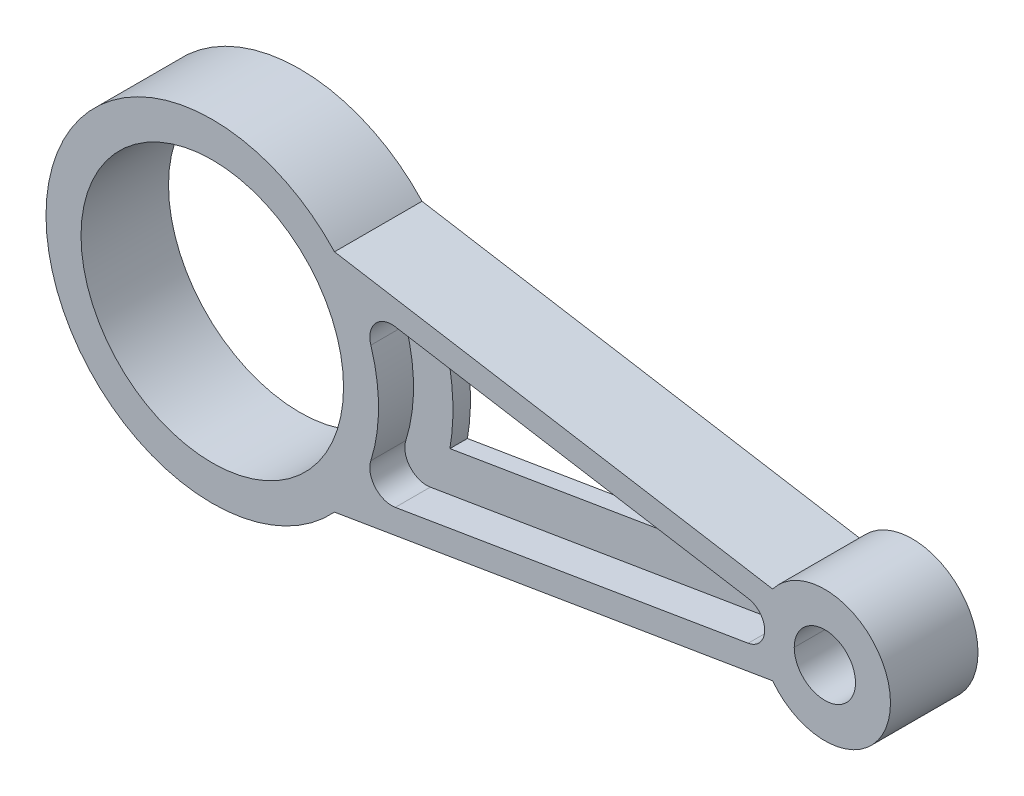
from build123d import *

# Parameters (mm, degrees)
SKETCH1_R           = 30
SKETCH1_R_2         = 7
BOSS_EXTRUDE1_DEPTH = 10
CUT_EXTRUDE1_DEPTH  = 8
CUT_EXTRUDE2_DEPTH  = 161.040619844


with BuildPart() as part:
    # Sketch1 → Boss-Extrude1 (new, symmetric)
    with BuildSketch(Plane.XY):
        with BuildLine():
            Line((27.935473676, 25.760615491), (128.063755469, 9.084385863))
            ThreePointArc((128.063755469, 9.084385863), (155, 0), (128.063755469, -9.084385863))
            Line((128.063755469, -9.084385863), (27.935473676, -25.760615491))
            ThreePointArc((27.935473676, -25.760615491), (-38, 0), (27.935473676, 25.760615491))
        make_face()
        Circle(SKETCH1_R, mode=Mode.SUBTRACT)
        with Locations((140, 0)):
            Circle(SKETCH1_R_2, mode=Mode.SUBTRACT)
    extrude(amount=BOSS_EXTRUDE1_DEPTH, both=True)

    # Sketch2 → Cut-Extrude1 (cut)
    with BuildSketch(Plane.XY.offset(10)):
        with BuildLine():
            Line((41.828554558, 17.870982725), (122.478416149, 4.438857582))
            ThreePointArc((122.478416149, 4.438857582), (126.239130435, 0), (122.478416149, -4.438857582))
            Line((122.478416149, -4.438857582), (41.828554558, -17.870982725))
            ThreePointArc((41.828554558, -17.870982725), (37.231968897, -16.217361812), (36.238855523, -11.43439331))
            ThreePointArc((36.238855523, -11.43439331), (38, 0), (36.238855523, 11.43439331))
            ThreePointArc((36.238855523, 11.43439331), (37.231968897, 16.217361812), (41.828554558, 17.870982725))
        make_face()
    cut_extrude1 = extrude(amount=-CUT_EXTRUDE1_DEPTH, mode=Mode.SUBTRACT)

    # Mirror1: Cut-Extrude1 across plane
    add(cut_extrude1.mirror(Plane.XY), mode=Mode.SUBTRACT)

    # Sketch3 → Cut-Extrude2 (cut, through all)
    with BuildSketch(Plane.XY.offset(2)):
        with BuildLine():
            ThreePointArc((46.314154572, -7.999942891), (47, 0), (46.314154572, 7.999942891))
            Line((46.314154572, 7.999942891), (94.347826087, 0))
            Line((94.347826087, 0), (46.314154572, -7.999942891))
        make_face()
    extrude(amount=-CUT_EXTRUDE2_DEPTH, mode=Mode.SUBTRACT)


solid = part.part
